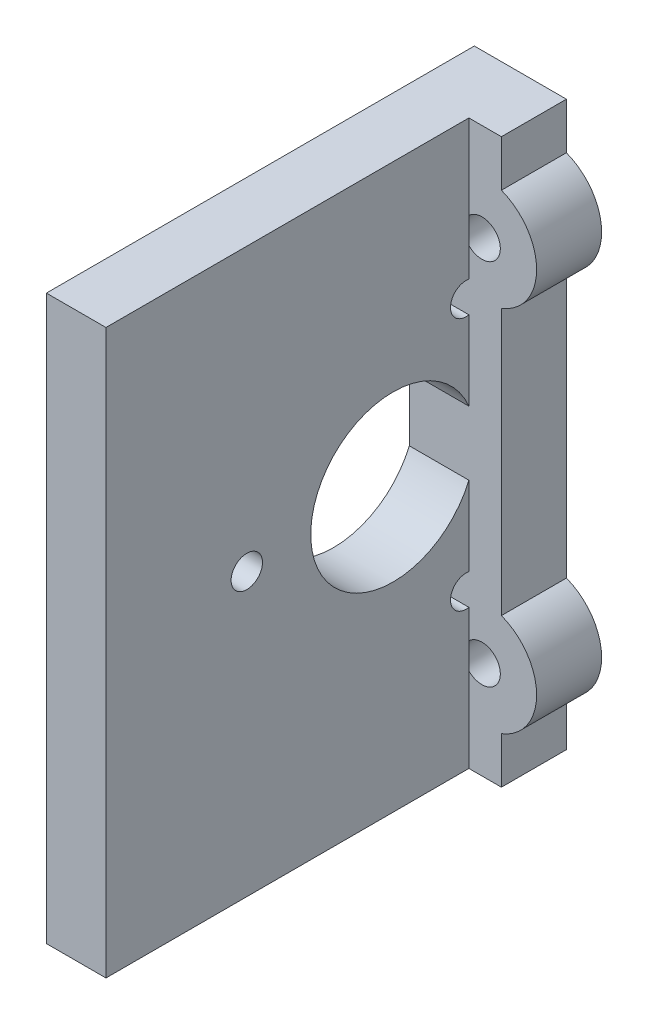
from build123d import *

# Parameters (mm, degrees)
SKETCH1_W           = 39.5
SKETCH1_H           = 52
SKETCH1_R           = 1.45
BOSS_EXTRUDE1_DEPTH = 5.5
SKETCH2_R           = 7.6
CUT_EXTRUDE1_DEPTH  = 5.5
SKETCH3_W           = 8.5
SKETCH3_H           = 52
BOSS_EXTRUDE2_DEPTH = 6
SKETCH4_R           = 5.05
SKETCH4_R_2         = 1.7
BOSS_EXTRUDE3_DEPTH = 6
SKETCH5_R           = 5.05
SKETCH5_R_2         = 1.7
BOSS_EXTRUDE4_DEPTH = 6
SKETCH6_R           = 1.7
CUT_EXTRUDE2_DEPTH  = 6


with BuildPart() as part:
    # Sketch1 → Boss-Extrude1 (new body)
    with BuildSketch(Plane(origin=(264, 0, 0), x_dir=(0, 0, -1), z_dir=(1, 0, 0))):
        with Locations((-306.75, 300)):
            Rectangle(SKETCH1_W, SKETCH1_H)
        with Locations((-313.5, 300)):
            Circle(SKETCH1_R, mode=Mode.SUBTRACT)
        with Locations((-293.25, 311.691342951)):
            Circle(SKETCH1_R, mode=Mode.SUBTRACT)
        with Locations((-293.25, 288.308657049)):
            Circle(SKETCH1_R, mode=Mode.SUBTRACT)
    extrude(amount=BOSS_EXTRUDE1_DEPTH)

    # Sketch2 → Cut-Extrude1 (cut)
    with BuildSketch(Plane(origin=(264, 0, 0), x_dir=(0, 0, -1), z_dir=(1, 0, 0))):
        with Locations((-300, 300)):
            Circle(SKETCH2_R)
    extrude(amount=CUT_EXTRUDE1_DEPTH, mode=Mode.SUBTRACT)

    # Sketch3 → Boss-Extrude2 (add)
    with BuildSketch(Plane.XY.offset(287)):
        with Locations((268.25, 300)):
            Rectangle(SKETCH3_W, SKETCH3_H)
    extrude(amount=BOSS_EXTRUDE2_DEPTH)

    # Sketch4 → Boss-Extrude3 (add)
    with BuildSketch(Plane.XY.offset(287)):
        with Locations((270.7, 283)):
            Circle(SKETCH4_R)
        with Locations((270.7, 283)):
            Circle(SKETCH4_R_2, mode=Mode.SUBTRACT)
    extrude(amount=BOSS_EXTRUDE3_DEPTH)

    # Sketch5 → Boss-Extrude4 (add)
    with BuildSketch(Plane.XY.offset(287)):
        with Locations((270.7, 317)):
            Circle(SKETCH5_R)
        with Locations((270.7, 317)):
            Circle(SKETCH5_R_2, mode=Mode.SUBTRACT)
    extrude(amount=BOSS_EXTRUDE4_DEPTH)

    # Sketch6 → Cut-Extrude2 (cut)
    with BuildSketch(Plane.XY.offset(287)):
        with Locations(Location((270.7, 283, 0), (0, 0, 225.099127844))):
            Circle(SKETCH6_R)
        with Locations(Location((270.7, 317, 0), (0, 0, 225.099127844))):
            Circle(SKETCH6_R)
    extrude(amount=CUT_EXTRUDE2_DEPTH, mode=Mode.SUBTRACT)


solid = part.part
